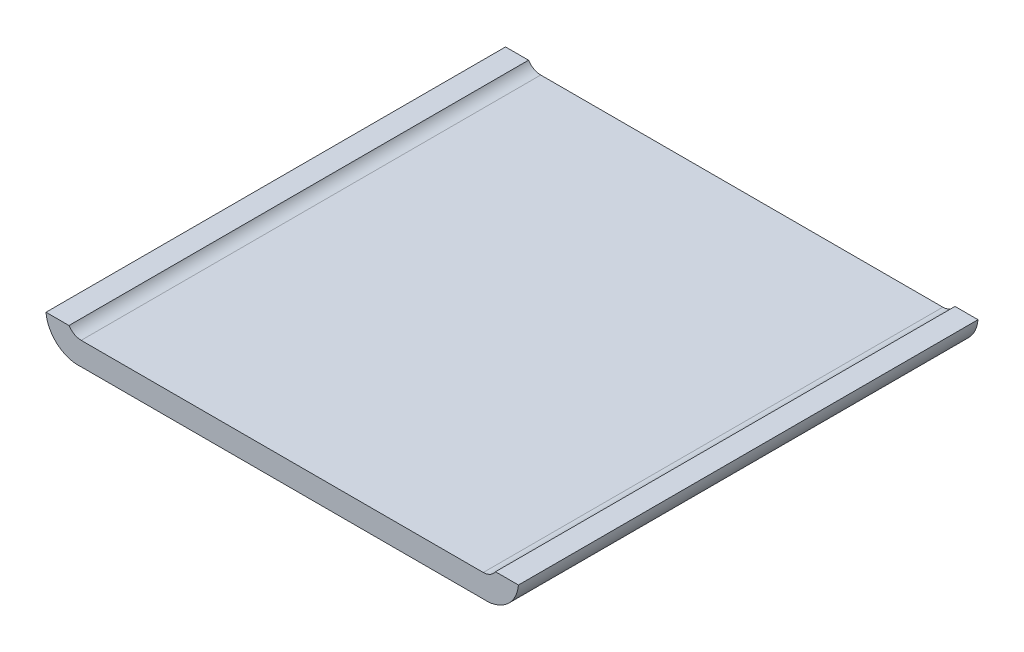
from build123d import *

# Parameters (mm, degrees)
SKETCH1_W           = 350
SKETCH1_H           = 20
BOSS_EXTRUDE1_DEPTH = 400
BOSS_EXTRUDE2_DEPTH = 400


with BuildPart() as part:
    # Sketch1 → Boss-Extrude1 (new body)
    with BuildSketch(Plane.XY):
        Rectangle(SKETCH1_W, SKETCH1_H)
    extrude(amount=BOSS_EXTRUDE1_DEPTH)

    # Sketch2 → Boss-Extrude2 (add)
    with BuildSketch(Plane.XY):
        with BuildLine():
            Line((-175, 10), (-175, -10))
            ThreePointArc((-175, -10), (-195.66613877, -3.40269315), (-205.614305224, 15.875474127))
            Line((-205.614305224, 15.875474127), (-185.614305224, 15.875474127))
            ThreePointArc((-185.614305224, 15.875474127), (-181.041918581, 11.610349673), (-175, 10))
        make_face()
    boss_extrude2 = extrude(amount=BOSS_EXTRUDE2_DEPTH)

    # Mirror1: Boss-Extrude2 across plane
    add(boss_extrude2.mirror(Plane(origin=(0, 0, 0), x_dir=(0, 0, 1), z_dir=(1, 0, 0))))


solid = part.part
